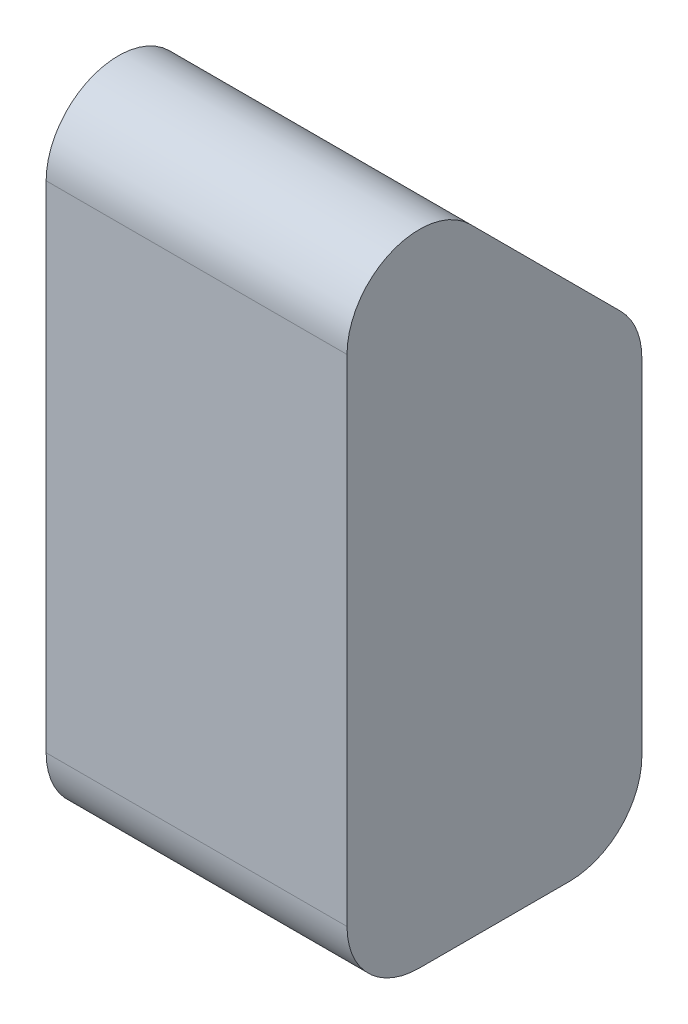
from build123d import *

# Parameters (mm, degrees)
BOSS_EXTRUDE1_DEPTH      = 0.5
BOSS_EXTRUDE1_DEPTH_BACK = 0.5


with BuildPart() as part:
    # Sketch1 → Boss-Extrude1 (new, two sides: drawn at the far end of the back side and taken through both)
    with BuildSketch(Plane.YZ.offset(-BOSS_EXTRUDE1_DEPTH_BACK)):
        with BuildLine():
            Line((-4.25, 2.51), (-3.103553391, 2.51))
            ThreePointArc((-3.103553391, 2.51), (-3.011709367, 2.528268912), (-2.933847763, 2.580294373))
            Line((-2.933847763, 2.580294373), (-2.433847763, 3.080294373))
            ThreePointArc((-2.433847763, 3.080294373), (-2.381822303, 3.341844024), (-2.603553391, 3.49))
            Line((-2.603553391, 3.49), (-4.25, 3.49))
            ThreePointArc((-4.25, 3.49), (-4.419705627, 3.419705627), (-4.49, 3.25))
            Line((-4.49, 3.25), (-4.49, 2.75))
            ThreePointArc((-4.49, 2.75), (-4.419705627, 2.580294373), (-4.25, 2.51))
        make_face()
    extrude(amount=BOSS_EXTRUDE1_DEPTH + BOSS_EXTRUDE1_DEPTH_BACK)


solid = part.part
